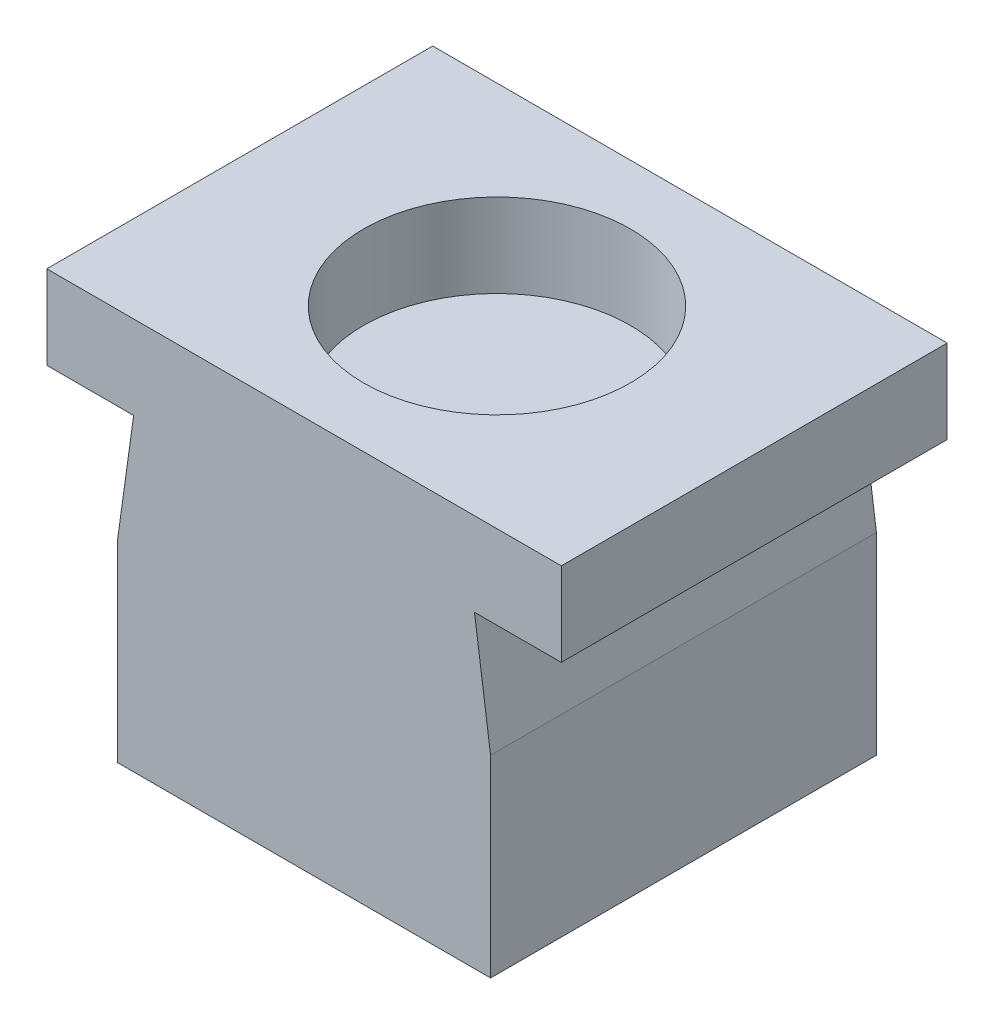
from build123d import *

# Parameters (mm, degrees)
BOSS_EXTRUDE1_DEPTH      = 15
BOSS_EXTRUDE1_DEPTH_BACK = 15
SKETCH2_R                = 10.375
CUT_EXTRUDE1_DEPTH       = 6.5


with BuildPart() as part:
    # Sketch1 → Boss-Extrude1 (new, two sides: drawn at the far end of the back side and taken through both)
    with BuildSketch(Plane.XY.offset(-BOSS_EXTRUDE1_DEPTH_BACK)):
        Polygon((-20, 6.5), (-20, 0), (-13.25, 0), (-14.5, -9), (-14.5, -24), (14.5, -24), (14.5, -9), (13.25, 0), (20, 0), (20, 6.5), align=None)
    extrude(amount=BOSS_EXTRUDE1_DEPTH + BOSS_EXTRUDE1_DEPTH_BACK)

    # Sketch2 → Cut-Extrude1 (cut)
    with BuildSketch(Plane(origin=(0, 6.5, 0), x_dir=(1, 0, 0), z_dir=(0, 1, 0))):
        Circle(SKETCH2_R)
    extrude(amount=-CUT_EXTRUDE1_DEPTH, mode=Mode.SUBTRACT)


solid = part.part
